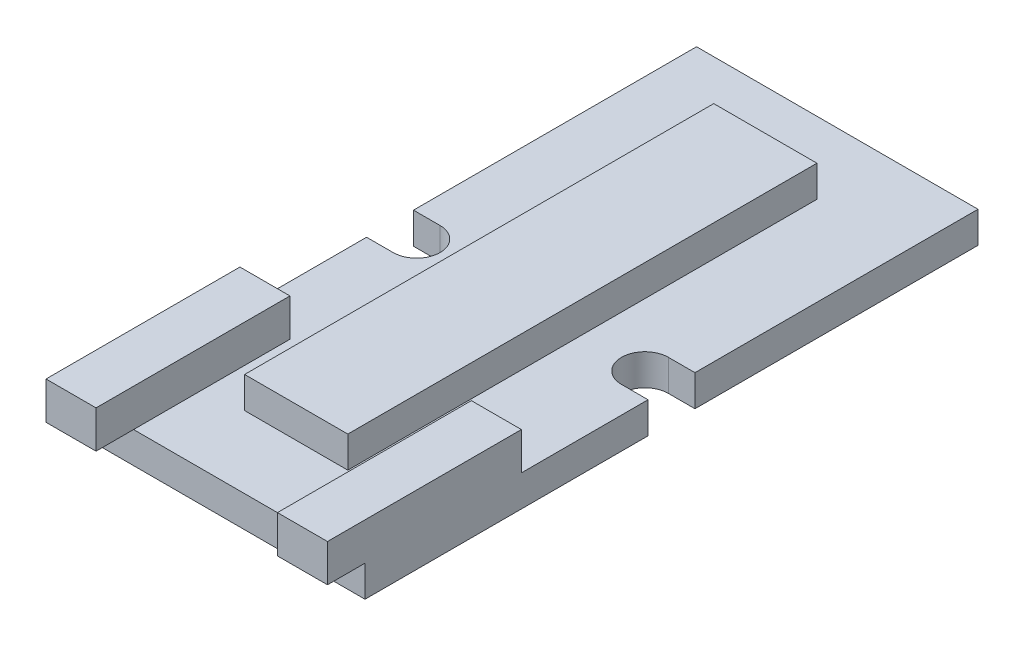
from build123d import *

# Parameters (mm, degrees)
BOSS_EXTRUDE1_DEPTH = 1
SKETCH2_W           = 3.3
SKETCH2_H           = 15
BOSS_EXTRUDE2_DEPTH = 1
SKETCH3_W           = 1.6
SKETCH3_H           = 5
BOSS_EXTRUDE3_DEPTH = 1.2
SKETCH4_W           = 1.6
SKETCH4_H           = 1.2
BOSS_EXTRUDE4_DEPTH = 1.2


with BuildPart() as part:
    # Sketch1 → Boss-Extrude1 (new body)
    with BuildSketch(Plane(origin=(0, 0, 0), x_dir=(1, 0, 0), z_dir=(0, 1, 0))):
        with BuildLine():
            Line((-4.5, -0.75), (-4.5, -9.8))
            Line((-4.5, -9.8), (4.5, -9.8))
            Line((4.5, -9.8), (4.5, -0.75))
            Line((4.5, -0.75), (3.65, -0.75))
            ThreePointArc((3.65, -0.75), (2.9, 0), (3.65, 0.75))
            Line((3.65, 0.75), (4.5, 0.75))
            Line((4.5, 0.75), (4.5, 9.8))
            Line((4.5, 9.8), (-4.5, 9.8))
            Line((-4.5, 9.8), (-4.5, 0.75))
            Line((-4.5, 0.75), (-3.65, 0.75))
            ThreePointArc((-3.65, 0.75), (-3.119669914, 0.530330086), (-2.9, 0))
            ThreePointArc((-2.9, 0), (-3.119669914, -0.530330086), (-3.65, -0.75))
            Line((-3.65, -0.75), (-4.5, -0.75))
        make_face()
    extrude(amount=BOSS_EXTRUDE1_DEPTH)

    # Sketch2 → Boss-Extrude2 (add)
    with BuildSketch(Plane(origin=(0, 1, 0), x_dir=(1, 0, 0), z_dir=(0, 1, 0))):
        Rectangle(SKETCH2_W, SKETCH2_H)
    extrude(amount=BOSS_EXTRUDE2_DEPTH)

    # Sketch3 → Boss-Extrude3 (add)
    with BuildSketch(Plane(origin=(0, 1, 0), x_dir=(1, 0, 0), z_dir=(0, 1, 0))):
        with Locations((-3.7, -7.3)):
            Rectangle(SKETCH3_W, SKETCH3_H)
        with Locations((3.7, -7.3)):
            Rectangle(SKETCH3_W, SKETCH3_H)
    extrude(amount=BOSS_EXTRUDE3_DEPTH)

    # Sketch4 → Boss-Extrude4 (add)
    with BuildSketch(Plane.XY.offset(9.8)):
        with Locations((-3.7, 1.6)):
            Rectangle(SKETCH4_W, SKETCH4_H)
        with Locations((3.7, 1.6)):
            Rectangle(SKETCH4_W, SKETCH4_H)
    extrude(amount=BOSS_EXTRUDE4_DEPTH)


solid = part.part
